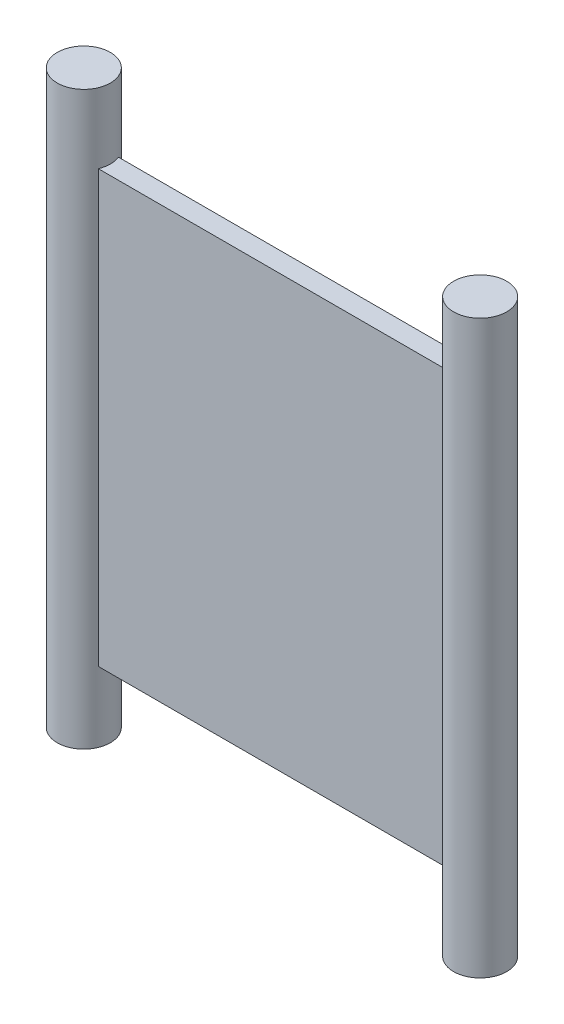
from build123d import *

# Parameters (mm, degrees)
SKETCH1_W           = 19.77
SKETCH1_H           = 1
BOSS_EXTRUDE1_DEPTH = 21.5
SKETCH2_R           = 1.325
BOSS_EXTRUDE2_DEPTH = 14.25


with BuildPart() as part:
    # Sketch1 → Boss-Extrude1 (new body)
    with BuildSketch(Plane(origin=(0, 0, 0), x_dir=(1, 0, 0), z_dir=(0, 1, 0))):
        Rectangle(SKETCH1_W, SKETCH1_H)
    extrude(amount=BOSS_EXTRUDE1_DEPTH)

    # Sketch2 → Boss-Extrude2 (add, symmetric)
    with BuildSketch(Plane(origin=(0, 10.75, 0), x_dir=(1, 0, 0), z_dir=(0, 1, 0))):
        with Locations(Location((-9.885, 0, 0), (0, 0, 270))):
            Circle(SKETCH2_R)
        with Locations(Location((9.885, 0, 0), (0, 0, 270))):
            Circle(SKETCH2_R)
    extrude(amount=BOSS_EXTRUDE2_DEPTH, both=True)


solid = part.part
